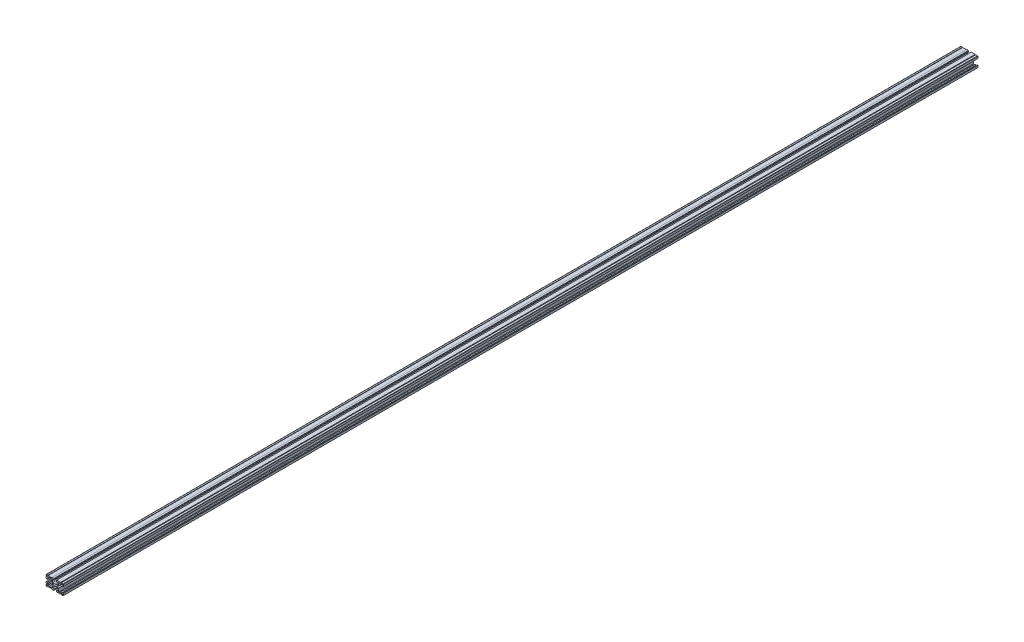
from build123d import *

# Parameters (mm, degrees)
EXTRUDE1_DEPTH = 3962.4


with BuildPart() as part:
    # Sketch1 → Extrude1 (new body)
    with BuildSketch(Plane.XY):
        with BuildLine():
            Line((57.489629067, 54.335654777), (63.36017209, 52.198951858))
            ThreePointArc((63.36017209, 52.198951858), (65.532, 51.816), (67.70382791, 52.198951858))
            Line((67.70382791, 52.198951858), (73.574370933, 54.335654777))
            ThreePointArc((73.574370933, 54.335654777), (75.846711611, 56.079283106), (76.708, 58.810940884))
            Line((76.708, 58.810940884), (76.708, 64.1985))
            Line((76.708, 64.1985), (70.739, 64.1985))
            Line((70.739, 64.1985), (70.739, 68.4911))
            Line((70.739, 68.4911), (71.5772, 68.4911))
            Line((71.5772, 68.4911), (71.5772, 70.1675))
            Line((71.5772, 70.1675), (88.646, 70.1675))
            Line((88.646, 70.1675), (88.646, 67.5005))
            Line((88.646, 67.5005), (91.694, 67.5005))
            Line((91.694, 67.5005), (91.694, 70.1675))
            Line((91.694, 70.1675), (99.695, 70.1675))
            Line((99.695, 70.1675), (99.695, 68.8975))
            Line((99.695, 68.8975), (100.584, 68.8975))
            Line((100.584, 68.8975), (100.584, 60.452))
            Line((100.584, 60.452), (98.679, 60.452))
            Line((98.679, 60.452), (97.831669473, 64.274061015))
            ThreePointArc((97.831669473, 64.274061015), (96.023287752, 67.777050786), (92.964, 65.2907))
            Line((92.964, 65.2907), (92.964, 63.3349))
            Line((92.964, 63.3349), (88.646, 63.3349))
            ThreePointArc((88.646, 63.3349), (86.612787287, 63.79072468), (84.968777108, 65.070943647))
            ThreePointArc((84.968777108, 65.070943647), (83.688613066, 65.688239697), (82.2833, 65.9003))
            Line((82.2833, 65.9003), (80.518, 65.9003))
            Line((80.518, 65.9003), (80.518, 52.264489638))
            ThreePointArc((80.518, 52.264489638), (80.237787924, 51.737848841), (79.644455026, 51.675998945))
            ThreePointArc((79.644455026, 51.675998945), (73.914, 47.8155), (79.644455026, 43.955001055))
            ThreePointArc((79.644455026, 43.955001055), (80.237787924, 43.893151159), (80.518, 43.366510362))
            Line((80.518, 43.366510362), (80.518, 29.7307))
            Line((80.518, 29.7307), (82.2833, 29.7307))
            ThreePointArc((82.2833, 29.7307), (83.688613066, 29.942760303), (84.968777108, 30.560056353))
            ThreePointArc((84.968777108, 30.560056353), (86.612787287, 31.84027532), (88.646, 32.2961))
            Line((88.646, 32.2961), (92.964, 32.2961))
            Line((92.964, 32.2961), (92.964, 30.3403))
            ThreePointArc((92.964, 30.3403), (96.023287752, 27.853949214), (97.831669473, 31.356938985))
            Line((97.831669473, 31.356938985), (98.679, 35.179))
            Line((98.679, 35.179), (100.584, 35.179))
            Line((100.584, 35.179), (100.584, 26.7335))
            Line((100.584, 26.7335), (99.695, 26.7335))
            Line((99.695, 26.7335), (99.695, 25.4635))
            Line((99.695, 25.4635), (91.694, 25.4635))
            Line((91.694, 25.4635), (91.694, 28.1305))
            Line((91.694, 28.1305), (88.646, 28.1305))
            Line((88.646, 28.1305), (88.646, 25.4635))
            Line((88.646, 25.4635), (71.5772, 25.4635))
            Line((71.5772, 25.4635), (71.5772, 27.1399))
            Line((71.5772, 27.1399), (70.739, 27.1399))
            Line((70.739, 27.1399), (70.739, 31.4325))
            Line((70.739, 31.4325), (76.708, 31.4325))
            Line((76.708, 31.4325), (76.708, 36.820059116))
            ThreePointArc((76.708, 36.820059116), (75.846711611, 39.551716894), (73.574370933, 41.295345223))
            Line((73.574370933, 41.295345223), (67.70382791, 43.432048142))
            ThreePointArc((67.70382791, 43.432048142), (65.532, 43.815), (63.36017209, 43.432048142))
            Line((63.36017209, 43.432048142), (57.489629067, 41.295345223))
            ThreePointArc((57.489629067, 41.295345223), (55.217288389, 39.551716894), (54.356, 36.820059116))
            Line((54.356, 36.820059116), (54.356, 31.4325))
            Line((54.356, 31.4325), (60.325, 31.4325))
            Line((60.325, 31.4325), (60.325, 27.1399))
            Line((60.325, 27.1399), (59.4868, 27.1399))
            Line((59.4868, 27.1399), (59.4868, 25.4635))
            Line((59.4868, 25.4635), (51.7144, 25.4635))
            Line((51.7144, 25.4635), (51.7144, 26.9875))
            Line((51.7144, 26.9875), (34.0868, 26.9875))
            Line((34.0868, 26.9875), (34.0868, 25.4635))
            Line((34.0868, 25.4635), (28.575, 25.4635))
            ThreePointArc((28.575, 25.4635), (26.32993597, 26.39343597), (25.4, 28.6385))
            Line((25.4, 28.6385), (25.4, 30.3276))
            Line((25.4, 30.3276), (27.305, 30.3276))
            Line((27.305, 30.3276), (28.017944206, 29.062142075))
            ThreePointArc((28.017944206, 29.062142075), (32.679151557, 29.425310919), (29.397952167, 32.755847833))
            Line((29.397952167, 32.755847833), (27.305, 34.8488))
            Line((27.305, 34.8488), (25.4, 34.8488))
            Line((25.4, 34.8488), (25.4, 41.91))
            Line((25.4, 41.91), (27.051, 41.91))
            Line((27.051, 41.91), (27.051, 42.799))
            Line((27.051, 42.799), (31.369, 42.799))
            Line((31.369, 42.799), (31.369, 36.8173))
            Line((31.369, 36.8173), (36.449, 36.8173))
            Line((36.449, 36.8173), (36.449, 33.9725))
            ThreePointArc((36.449, 33.9725), (37.37893597, 31.72743597), (39.624, 30.7975))
            Line((39.624, 30.7975), (50.546, 30.7975))
            Line((50.546, 30.7975), (50.546, 43.366510362))
            ThreePointArc((50.546, 43.366510362), (50.826212076, 43.893151159), (51.419544974, 43.955001055))
            ThreePointArc((51.419544974, 43.955001055), (57.15, 47.8155), (51.419544974, 51.675998945))
            ThreePointArc((51.419544974, 51.675998945), (50.826212076, 51.737848841), (50.546, 52.264489638))
            Line((50.546, 52.264489638), (50.546, 64.8335))
            Line((50.546, 64.8335), (39.624, 64.8335))
            ThreePointArc((39.624, 64.8335), (37.37893597, 63.90356403), (36.449, 61.6585))
            Line((36.449, 61.6585), (36.449, 58.8137))
            Line((36.449, 58.8137), (31.369, 58.8137))
            Line((31.369, 58.8137), (31.369, 52.832))
            Line((31.369, 52.832), (27.051, 52.832))
            Line((27.051, 52.832), (27.051, 53.721))
            Line((27.051, 53.721), (25.4, 53.721))
            Line((25.4, 53.721), (25.4, 60.7822))
            Line((25.4, 60.7822), (27.305, 60.7822))
            Line((27.305, 60.7822), (29.397952167, 62.875152167))
            ThreePointArc((29.397952167, 62.875152167), (32.679151557, 66.205689081), (28.017944206, 66.568857925))
            Line((28.017944206, 66.568857925), (27.305, 65.3034))
            Line((27.305, 65.3034), (25.4, 65.3034))
            Line((25.4, 65.3034), (25.4, 66.9925))
            ThreePointArc((25.4, 66.9925), (26.32993597, 69.23756403), (28.575, 70.1675))
            Line((28.575, 70.1675), (34.0868, 70.1675))
            Line((34.0868, 70.1675), (34.0868, 68.6435))
            Line((34.0868, 68.6435), (51.7144, 68.6435))
            Line((51.7144, 68.6435), (51.7144, 70.1675))
            Line((51.7144, 70.1675), (59.4868, 70.1675))
            Line((59.4868, 70.1675), (59.4868, 68.4911))
            Line((59.4868, 68.4911), (60.325, 68.4911))
            Line((60.325, 68.4911), (60.325, 64.1985))
            Line((60.325, 64.1985), (54.356, 64.1985))
            Line((54.356, 64.1985), (54.356, 58.810940884))
            ThreePointArc((54.356, 58.810940884), (55.217288389, 56.079283106), (57.489629067, 54.335654777))
        make_face()
    extrude(amount=EXTRUDE1_DEPTH)


solid = part.part
